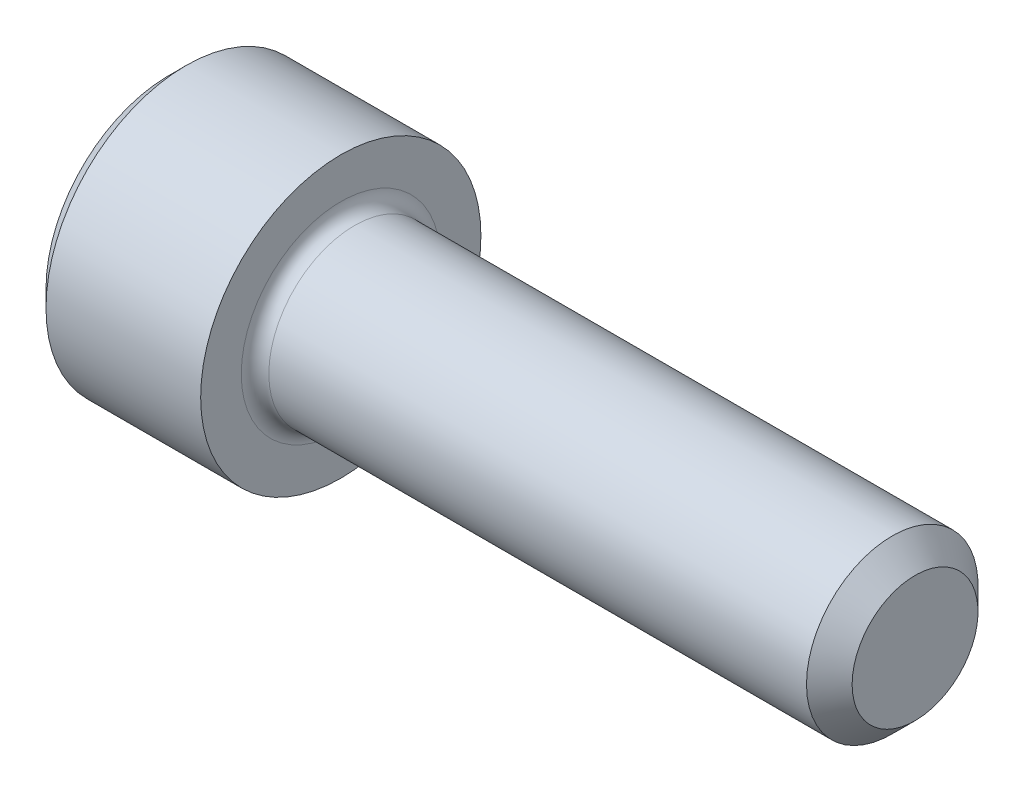
from build123d import *

# Parameters (mm, degrees)
FILLET1_R   = 0.2286
HEX_2_DEPTH = 1.2954


with BuildPart() as part:
    # BodySke → Base-Revolve (revolve)
    with BuildSketch(Plane.XY, mode=Mode.PRIVATE) as base_revolve_sk:
        Polygon((0, 0), (0, 2.0447), (0.2794, 2.3241), (2.8448, 2.3241), (2.8448, 1.4224), (11.99134, 1.4224), (12.3698, 1.04394), (12.3698, 0), align=None)
    revolve(base_revolve_sk.sketch.rotate(Axis((-31.75, 0, 0), (1, 0, 0)), 90), axis=Axis((-31.75, 0, 0), (1, 0, 0)))

    # Fillet1
    fillet1_edges = [part.edges().sort_by_distance(p)[0] for p in [
        (2.8448, 0, -1.4224),
    ]]
    fillet(fillet1_edges, radius=FILLET1_R)

    # Sketch2 → Hex-PreBroach (revolve, cut)
    with BuildSketch(Plane.XY, mode=Mode.PRIVATE) as hex_prebroach_sk:
        Polygon((0, 1.1938), (1.2954, 1.1938), (1.984640751, 0), (0, 0), align=None)
    revolve(hex_prebroach_sk.sketch.rotate(Axis((0, 0, 0), (1, 0, 0)), 90), axis=Axis((0, 0, 0), (1, 0, 0)), mode=Mode.SUBTRACT)

    # Sketch3 → Hex 2 (cut)
    with BuildSketch(Plane(origin=(0, 0, 0), x_dir=(0, 0.500000000000001, 0.866025403784438), z_dir=(-1, 0, 0))):
        Polygon((0.689240751, 1.1938), (-0.689240751, 1.1938), (-1.378481503, 0), (-0.689240751, -1.1938), (0.689240751, -1.1938), (1.378481503, 0), align=None)
    extrude(amount=-HEX_2_DEPTH, mode=Mode.SUBTRACT)


solid = part.part
